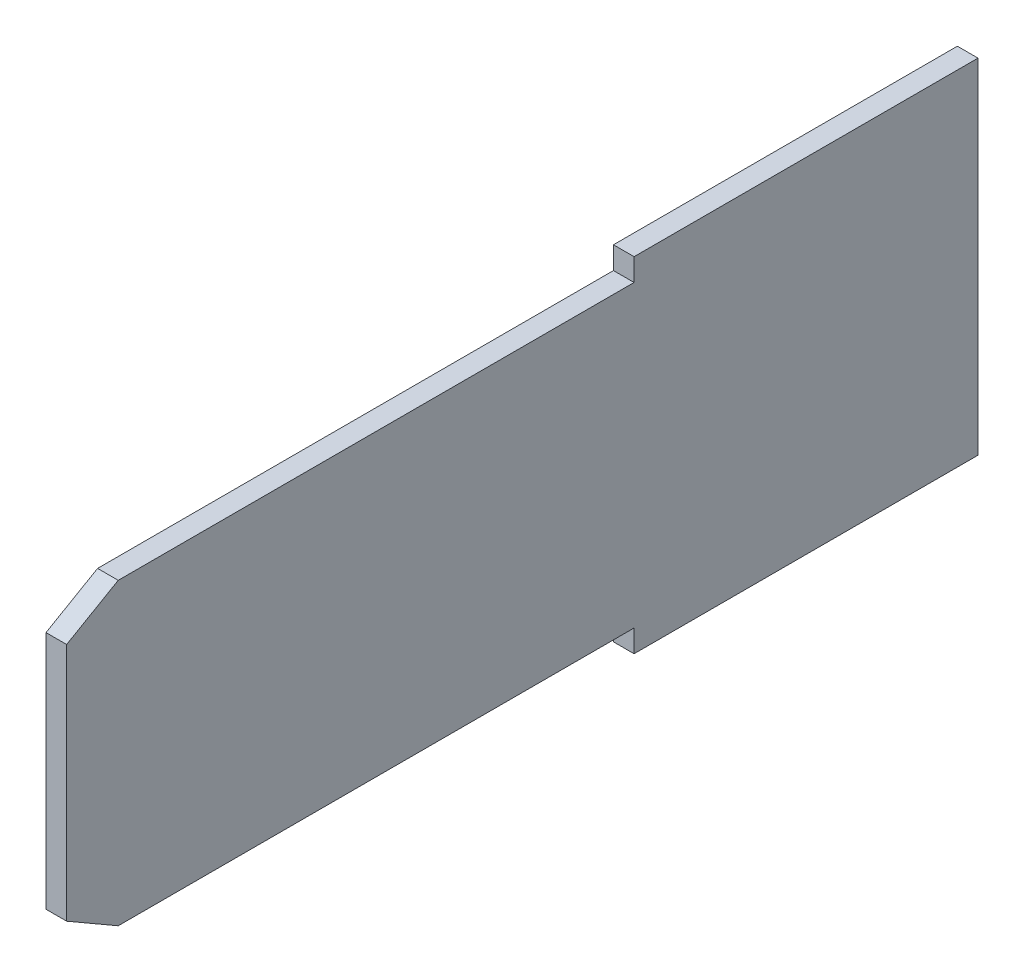
from build123d import *

# Parameters (mm, degrees)
EXTRUDE_1_DEPTH = 3


with BuildPart() as part:
    # Эскиз1 → Бобышка-Вытянуть1 (new, symmetric)
    with BuildSketch(Plane(origin=(0, 0, 0), x_dir=(0, 0, -1), z_dir=(1, 0, 0))):
        Polygon((100, -50), (100, 50), (0, 50), (0, 43.5), (-150, 43.5), (-165, 34.839745962), (-165, -34.839745962), (-150, -43.5), (0, -43.5), (0, -50), align=None)
    extrude(amount=EXTRUDE_1_DEPTH, both=True)


solid = part.part
